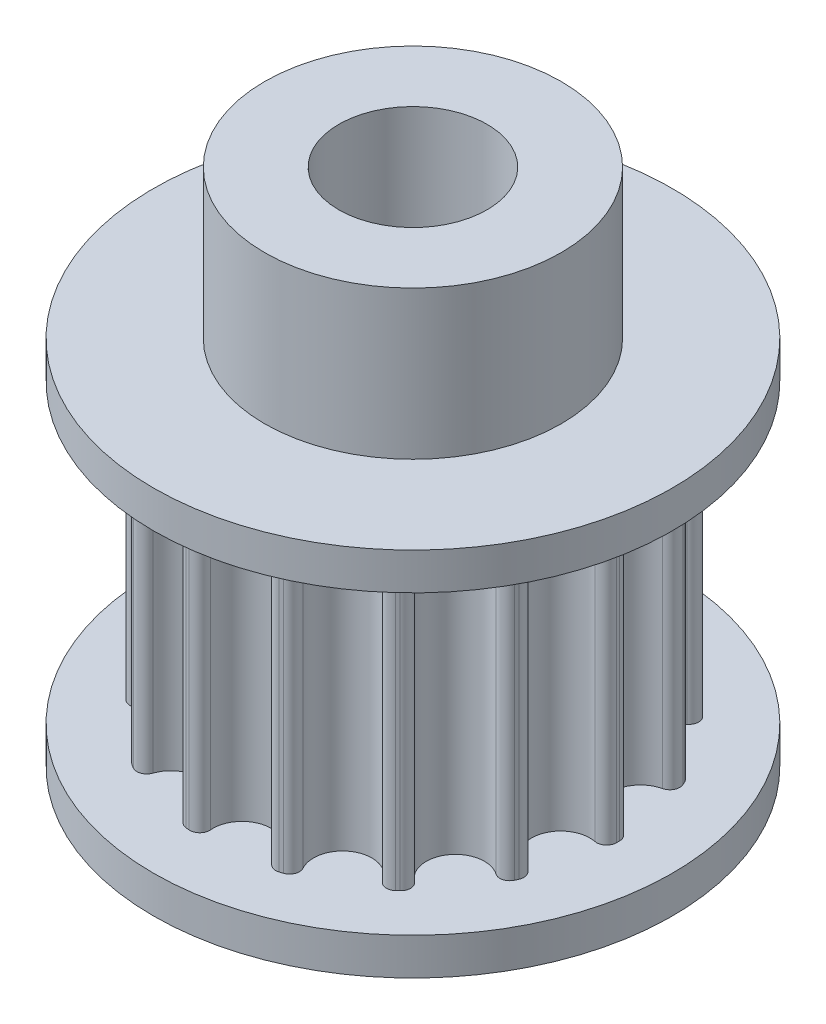
from build123d import *

# Parameters (mm, degrees)
SKETCH1_R           = 4
BOSS_EXTRUDE1_DEPTH = 8
SKETCH2_R           = 8
SKETCH2_R_2         = 4
BOSS_EXTRUDE2_DEPTH = 10
SKETCH2_3_R         = 14
SKETCH2_3_R_2       = 4
BOSS_EXTRUDE3_DEPTH = 2


with BuildPart() as part:
    # Sketch1 → Boss-Extrude1 (new, symmetric)
    with BuildSketch(Plane(origin=(0, 0, 0), x_dir=(1, 0, 0), z_dir=(0, 1, 0))):
        with BuildLine():
            ThreePointArc((10.430731661, 0.607363835), (8.588743102, 1.825593703), (9.775984656, 3.687706308))
            ThreePointArc((9.775984656, 3.687706308), (10.132691352, 3.967450083), (10.145367447, 4.420589756))
            ThreePointArc((10.145367447, 4.420589756), (10.127694476, 4.460930288), (10.109861101, 4.501200167))
            ThreePointArc((10.109861101, 4.501200167), (10.091867606, 4.541398755), (10.073714274, 4.581525417))
            ThreePointArc((10.073714274, 4.581525417), (9.728483908, 4.875314866), (9.281910401, 4.797415253))
            ThreePointArc((9.281910401, 4.797415253), (7.103671393, 5.161119372), (7.430881092, 7.345138528))
            ThreePointArc((7.430881092, 7.345138528), (7.64296683, 7.745782868), (7.470238509, 8.16490239))
            ThreePointArc((7.470238509, 8.16490239), (7.437685474, 8.194567054), (7.405014641, 8.224101932))
            ThreePointArc((7.405014641, 8.224101932), (7.372226526, 8.253506556), (7.339321649, 8.282780461))
            ThreePointArc((7.339321649, 8.282780461), (6.904443081, 8.410752637), (6.52816251, 8.157949991))
            ThreePointArc((6.52816251, 8.157949991), (4.390310366, 7.604240615), (3.80091068, 9.732529569))
            ThreePointArc((3.80091068, 9.732529569), (3.831703908, 10.184799426), (3.503437469, 10.497429225))
            ThreePointArc((3.503437469, 10.497429225), (3.461633085, 10.511288732), (3.419773876, 10.52498176))
            ThreePointArc((3.419773876, 10.52498176), (3.377860505, 10.538508093), (3.335893634, 10.551867516))
            ThreePointArc((3.335893634, 10.551867516), (2.886561321, 10.491894868), (2.645636014, 10.107901062))
            ThreePointArc((2.645636014, 10.107901062), (0.917824792, 8.732519573), (-0.486271719, 10.43707783))
            ThreePointArc((-0.486271719, 10.43707783), (-0.642095428, 10.862771638), (-1.069139738, 11.01485518))
            ThreePointArc((-1.069139738, 11.01485518), (-1.112967112, 11.010513096), (-1.156776859, 11.005996626))
            ThreePointArc((-1.156776859, 11.005996626), (-1.200568284, 11.001305842), (-1.244340695, 10.996440818))
            ThreePointArc((-1.244340695, 10.996440818), (-1.630433115, 10.758893161), (-1.694344984, 10.310104213))
            ThreePointArc((-1.694344984, 10.310104213), (-2.713361027, 8.350866564), (-4.68937332, 9.336960516))
            ThreePointArc((-4.68937332, 9.336960516), (-5.004870632, 9.662471948), (-5.456852971, 9.627712608))
            ThreePointArc((-5.456852971, 9.627712608), (-5.495125185, 9.605919718), (-5.533310366, 9.583974688))
            ThreePointArc((-5.533310366, 9.583974688), (-5.57140791, 9.561877866), (-5.609417214, 9.539629602))
            ThreePointArc((-5.609417214, 9.539629602), (-5.865510854, 9.165581084), (-5.741358341, 8.729596681))
            ThreePointArc((-5.741358341, 8.729596681), (-5.875382075, 6.525272861), (-8.081639672, 6.622397905))
            ThreePointArc((-8.081639672, 6.622397905), (-8.502258236, 6.791443078), (-8.901026752, 6.575851062))
            ThreePointArc((-8.901026752, 6.575851062), (-8.927126192, 6.540375554), (-8.953084242, 6.504796459))
            ThreePointArc((-8.953084242, 6.504796459), (-8.978900494, 6.469114341), (-9.004574536, 6.433329764))
            ThreePointArc((-9.004574536, 6.433329764), (-9.086388479, 5.987456771), (-8.795638682, 5.639662576))
            ThreePointArc((-8.795638682, 5.639662576), (-8.021496185, 3.571400201), (-10.076517106, 2.762762534))
            ThreePointArc((-10.076517106, 2.762762534), (-10.52952815, 2.746112001), (-10.806132144, 2.386965126))
            ThreePointArc((-10.806132144, 2.386965126), (-10.815545979, 2.343941039), (-10.824788517, 2.300879828))
            ThreePointArc((-10.824788517, 2.300879828), (-10.833859611, 2.257782175), (-10.842759117, 2.214648764))
            ThreePointArc((-10.842759117, 2.214648764), (-10.73614699, 1.774046788), (-10.32907319, 1.574579578))
            ThreePointArc((-10.32907319, 1.574579578), (-8.780620732, 0), (-10.32907319, -1.574579578))
            ThreePointArc((-10.32907319, -1.574579578), (-10.73614699, -1.774046788), (-10.842759117, -2.214648764))
            ThreePointArc((-10.842759117, -2.214648764), (-10.833859611, -2.257782175), (-10.824788517, -2.300879828))
            ThreePointArc((-10.824788517, -2.300879828), (-10.815545979, -2.343941039), (-10.806132144, -2.386965126))
            ThreePointArc((-10.806132144, -2.386965126), (-10.52952815, -2.746112001), (-10.076517106, -2.762762534))
            ThreePointArc((-10.076517106, -2.762762534), (-8.021496185, -3.571400201), (-8.795638682, -5.639662576))
            ThreePointArc((-8.795638682, -5.639662576), (-9.086388479, -5.987456771), (-9.004574536, -6.433329764))
            ThreePointArc((-9.004574536, -6.433329764), (-8.978900494, -6.469114341), (-8.953084242, -6.504796459))
            ThreePointArc((-8.953084242, -6.504796459), (-8.927126192, -6.540375554), (-8.901026752, -6.575851062))
            ThreePointArc((-8.901026752, -6.575851062), (-8.502258236, -6.791443078), (-8.081639672, -6.622397905))
            ThreePointArc((-8.081639672, -6.622397905), (-5.875382075, -6.525272861), (-5.741358341, -8.729596681))
            ThreePointArc((-5.741358341, -8.729596681), (-5.865510854, -9.165581084), (-5.609417214, -9.539629602))
            ThreePointArc((-5.609417214, -9.539629602), (-5.57140791, -9.561877866), (-5.533310366, -9.583974688))
            ThreePointArc((-5.533310366, -9.583974688), (-5.495125185, -9.605919718), (-5.456852971, -9.627712608))
            ThreePointArc((-5.456852971, -9.627712608), (-5.004870632, -9.662471948), (-4.68937332, -9.336960516))
            ThreePointArc((-4.68937332, -9.336960516), (-2.713361027, -8.350866564), (-1.694344984, -10.310104213))
            ThreePointArc((-1.694344984, -10.310104213), (-1.630433115, -10.758893161), (-1.244340695, -10.996440818))
            ThreePointArc((-1.244340695, -10.996440818), (-1.200568284, -11.001305842), (-1.156776859, -11.005996626))
            ThreePointArc((-1.156776859, -11.005996626), (-1.112967112, -11.010513096), (-1.069139738, -11.01485518))
            ThreePointArc((-1.069139738, -11.01485518), (-0.642095428, -10.862771638), (-0.486271719, -10.43707783))
            ThreePointArc((-0.486271719, -10.43707783), (0.917824792, -8.732519573), (2.645636014, -10.107901062))
            ThreePointArc((2.645636014, -10.107901062), (2.886561321, -10.491894868), (3.335893634, -10.551867516))
            ThreePointArc((3.335893634, -10.551867516), (3.377860505, -10.538508093), (3.419773876, -10.52498176))
            ThreePointArc((3.419773876, -10.52498176), (3.461633085, -10.511288732), (3.503437469, -10.497429225))
            ThreePointArc((3.503437469, -10.497429225), (3.831703908, -10.184799426), (3.80091068, -9.732529569))
            ThreePointArc((3.80091068, -9.732529569), (4.390310366, -7.604240615), (6.52816251, -8.157949991))
            ThreePointArc((6.52816251, -8.157949991), (6.904443081, -8.410752637), (7.339321649, -8.282780461))
            ThreePointArc((7.339321649, -8.282780461), (7.372226526, -8.253506556), (7.405014641, -8.224101932))
            ThreePointArc((7.405014641, -8.224101932), (7.437685474, -8.194567054), (7.470238509, -8.16490239))
            ThreePointArc((7.470238509, -8.16490239), (7.64296683, -7.745782868), (7.430881092, -7.345138528))
            ThreePointArc((7.430881092, -7.345138528), (7.103671393, -5.161119372), (9.281910401, -4.797415253))
            ThreePointArc((9.281910401, -4.797415253), (9.728483908, -4.875314866), (10.073714274, -4.581525417))
            ThreePointArc((10.073714274, -4.581525417), (10.091867606, -4.541398755), (10.109861101, -4.501200167))
            ThreePointArc((10.109861101, -4.501200167), (10.127694476, -4.460930288), (10.145367447, -4.420589756))
            ThreePointArc((10.145367447, -4.420589756), (10.132691352, -3.967450083), (9.775984656, -3.687706308))
            ThreePointArc((9.775984656, -3.687706308), (8.588743102, -1.825593703), (10.430731661, -0.607363835))
            ThreePointArc((10.430731661, -0.607363835), (10.870381486, -0.496890864), (11.066270185, -0.088083006))
            ThreePointArc((11.066270185, -0.088083006), (11.066533095, -0.044041852), (11.066620732, 0))
            ThreePointArc((11.066620732, 0), (11.066533095, 0.044041852), (11.066270185, 0.088083006))
            ThreePointArc((11.066270185, 0.088083006), (10.870381486, 0.496890864), (10.430731661, 0.607363835))
        make_face()
        Circle(SKETCH1_R, mode=Mode.SUBTRACT)
    extrude(amount=BOSS_EXTRUDE1_DEPTH, both=True)

    # Sketch2 → Boss-Extrude2 (add)
    with BuildSketch(Plane(origin=(0, 8, 0), x_dir=(1, 0, 0), z_dir=(0, 1, 0))):
        Circle(SKETCH2_R)
        Circle(SKETCH2_R_2, mode=Mode.SUBTRACT)
    extrude(amount=BOSS_EXTRUDE2_DEPTH)

    # Sketch2<3> → Boss-Extrude3 (add)
    with BuildSketch(Plane(origin=(0, 8, 0), x_dir=(1, 0, 0), z_dir=(0, 1, 0))):
        Circle(SKETCH2_3_R)
        Circle(SKETCH2_3_R_2, mode=Mode.SUBTRACT)
    boss_extrude3 = extrude(amount=BOSS_EXTRUDE3_DEPTH)

    # Mirror1: Boss-Extrude3 across plane
    add(boss_extrude3.mirror(Plane.ZX))


solid = part.part
